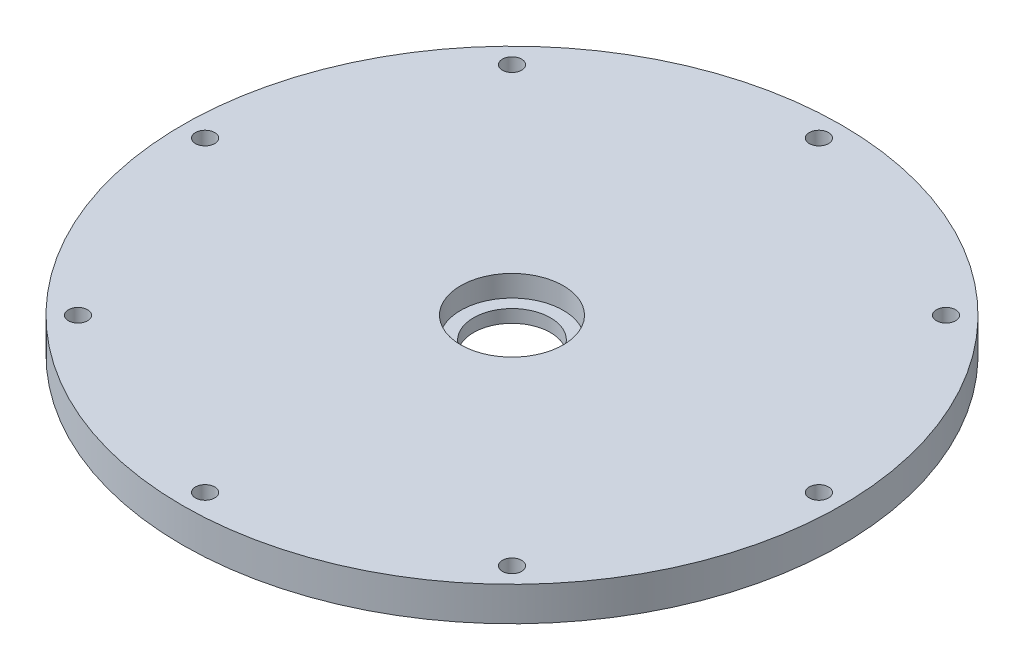
from build123d import *

# Parameters (mm, degrees)
SKETCH1_R           = 77.1
BOSS_EXTRUDE1_DEPTH = 8
SKETCH2_R           = 2.25
CUT_EXTRUDE1_DEPTH  = 110.328953164
SKETCH3_R           = 3
CUT_EXTRUDE2_DEPTH  = 5
SKETCH4_R           = 12
CUT_EXTRUDE3_DEPTH  = 5
SKETCH5_R           = 9
CUT_EXTRUDE4_DEPTH  = 5


with BuildPart() as part:
    # Sketch1 → Boss-Extrude1 (new body)
    with BuildSketch(Plane(origin=(0, 0, 0), x_dir=(1, 0, 0), z_dir=(0, 1, 0))):
        with Locations(Location((0, 0, 0), (0, 0, 270))):
            Circle(SKETCH1_R)
    extrude(amount=BOSS_EXTRUDE1_DEPTH)

    # Sketch2 → Cut-Extrude1 (cut, through all)
    with BuildSketch(Plane(origin=(0, 8, 0), x_dir=(1, 0, 0), z_dir=(0, 1, 0))):
        with Locations(Location((0, 71.8, 0), (0, 0, 270))):
            Circle(SKETCH2_R)
        with Locations(Location((50.770266889, 50.770266889, 0), (0, 0, 270))):
            Circle(SKETCH2_R)
        with Locations(Location((71.8, 0, 0), (0, 0, 270))):
            Circle(SKETCH2_R)
        with Locations(Location((50.770266889, -50.770266889, 0), (0, 0, 270))):
            Circle(SKETCH2_R)
        with Locations(Location((0, -71.8, 0), (0, 0, 270))):
            Circle(SKETCH2_R)
        with Locations(Location((-50.770266889, -50.770266889, 0), (0, 0, 270))):
            Circle(SKETCH2_R)
        with Locations(Location((-71.8, 0, 0), (0, 0, 270))):
            Circle(SKETCH2_R)
        with Locations(Location((-50.770266889, 50.770266889, 0), (0, 0, 270))):
            Circle(SKETCH2_R)
    extrude(amount=-CUT_EXTRUDE1_DEPTH, mode=Mode.SUBTRACT)

    # Sketch3 → Cut-Extrude2 (cut)
    with BuildSketch(Plane.XZ):
        with Locations(Location((60, 0, 0), (0, 0, 270))):
            Circle(SKETCH3_R)
        with Locations(Location((57.955549577, -15.529142706, 0), (0, 0, 270))):
            Circle(SKETCH3_R)
        with Locations(Location((51.961524227, -30, 0), (0, 0, 270))):
            Circle(SKETCH3_R)
        with Locations(Location((42.426406871, -42.426406871, 0), (0, 0, 270))):
            Circle(SKETCH3_R)
        with Locations(Location((30, -51.961524227, 0), (0, 0, 270))):
            Circle(SKETCH3_R)
        with Locations(Location((15.529142706, -57.955549577, 0), (0, 0, 270))):
            Circle(SKETCH3_R)
        with Locations(Location((0, -60, 0), (0, 0, 270))):
            Circle(SKETCH3_R)
        with Locations(Location((-15.529142706, -57.955549577, 0), (0, 0, 270))):
            Circle(SKETCH3_R)
        with Locations(Location((-30, -51.961524227, 0), (0, 0, 270))):
            Circle(SKETCH3_R)
        with Locations(Location((-42.426406871, -42.426406871, 0), (0, 0, 270))):
            Circle(SKETCH3_R)
        with Locations(Location((-51.961524227, -30, 0), (0, 0, 270))):
            Circle(SKETCH3_R)
        with Locations(Location((-57.955549577, -15.529142706, 0), (0, 0, 270))):
            Circle(SKETCH3_R)
        with Locations(Location((-60, 0, 0), (0, 0, 270))):
            Circle(SKETCH3_R)
        with Locations(Location((-57.955549577, 15.529142706, 0), (0, 0, 270))):
            Circle(SKETCH3_R)
        with Locations(Location((-51.961524227, 30, 0), (0, 0, 270))):
            Circle(SKETCH3_R)
        with Locations(Location((-42.426406871, 42.426406871, 0), (0, 0, 270))):
            Circle(SKETCH3_R)
        with Locations(Location((-30, 51.961524227, 0), (0, 0, 270))):
            Circle(SKETCH3_R)
        with Locations(Location((-15.529142706, 57.955549577, 0), (0, 0, 270))):
            Circle(SKETCH3_R)
        with Locations(Location((0, 60, 0), (0, 0, 270))):
            Circle(SKETCH3_R)
        with Locations(Location((15.529142706, 57.955549577, 0), (0, 0, 270))):
            Circle(SKETCH3_R)
        with Locations(Location((30, 51.961524227, 0), (0, 0, 270))):
            Circle(SKETCH3_R)
        with Locations(Location((42.426406871, 42.426406871, 0), (0, 0, 270))):
            Circle(SKETCH3_R)
        with Locations(Location((51.961524227, 30, 0), (0, 0, 270))):
            Circle(SKETCH3_R)
        with Locations(Location((57.955549577, 15.529142706, 0), (0, 0, 270))):
            Circle(SKETCH3_R)
    extrude(amount=-CUT_EXTRUDE2_DEPTH, mode=Mode.SUBTRACT)

    # Sketch4 → Cut-Extrude3 (cut)
    with BuildSketch(Plane(origin=(0, 8, 0), x_dir=(1, 0, 0), z_dir=(0, 1, 0))):
        with Locations(Location((0, 0, 0), (0, 0, 270))):
            Circle(SKETCH4_R)
    extrude(amount=-CUT_EXTRUDE3_DEPTH, mode=Mode.SUBTRACT)

    # Sketch5 → Cut-Extrude4 (cut)
    with BuildSketch(Plane(origin=(0, 3, 0), x_dir=(1, 0, 0), z_dir=(0, 1, 0))):
        with Locations(Location((0, 0, 0), (0, 0, 270))):
            Circle(SKETCH5_R)
    extrude(amount=-CUT_EXTRUDE4_DEPTH, mode=Mode.SUBTRACT)


solid = part.part
